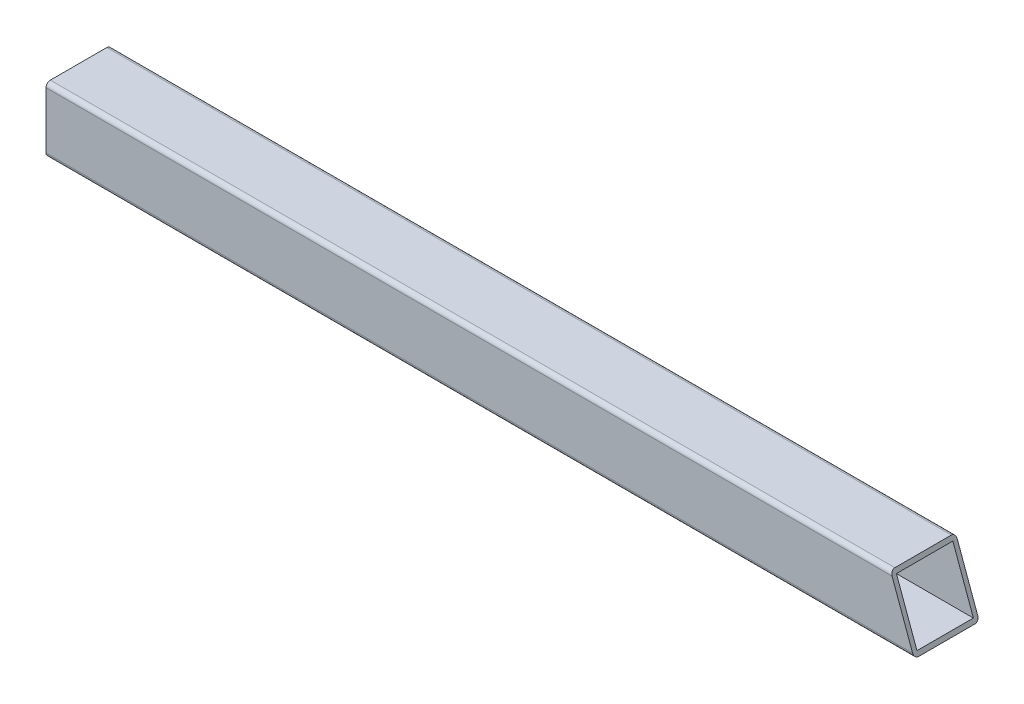
from build123d import *

# Parameters (mm, degrees)
SKETCH1_W               = 130
SKETCH1_H               = 130
EXTRUDE1_DEPTH          = 2000
CUT_EXTRUDE2_DEPTH      = 2012.218536112
CUT_EXTRUDE2_DEPTH_BACK = 2012.218536112


with BuildPart() as part:
    # Sketch1 → Extrude1 (new body)
    with BuildSketch(Plane(origin=(0, 0, 0), x_dir=(0, 0, -1), z_dir=(1, 0, 0))):
        with BuildLine():
            Line((10, 0), (140, 0))
            ThreePointArc((140, 0), (147.071067812, 2.928932188), (150, 10))
            Line((150, 10), (150, 140))
            ThreePointArc((150, 140), (147.071067812, 147.071067812), (140, 150))
            Line((140, 150), (10, 150))
            ThreePointArc((10, 150), (2.928932188, 147.071067812), (0, 140))
            Line((0, 140), (0, 10))
            ThreePointArc((0, 10), (2.928932188, 2.928932188), (10, 0))
        make_face()
        with Locations((75, 75)):
            Rectangle(SKETCH1_W, SKETCH1_H, mode=Mode.SUBTRACT)
    extrude(amount=EXTRUDE1_DEPTH)

    # Sketch2 → Cut-Extrude2 (cut, two sides: drawn at the far end of the back side and taken through both)
    with BuildSketch(Plane.XY.offset(-CUT_EXTRUDE2_DEPTH_BACK)):
        Polygon((3375.343105648, -3778.724126769), (2000, 0), (1945.40446486, 150), (570.061359213, 3928.724126769), (8127.509612751, 6679.410338064), (10932.791359186, -1028.037915474), align=None)
    extrude(amount=CUT_EXTRUDE2_DEPTH + CUT_EXTRUDE2_DEPTH_BACK, mode=Mode.SUBTRACT)


solid = part.part
